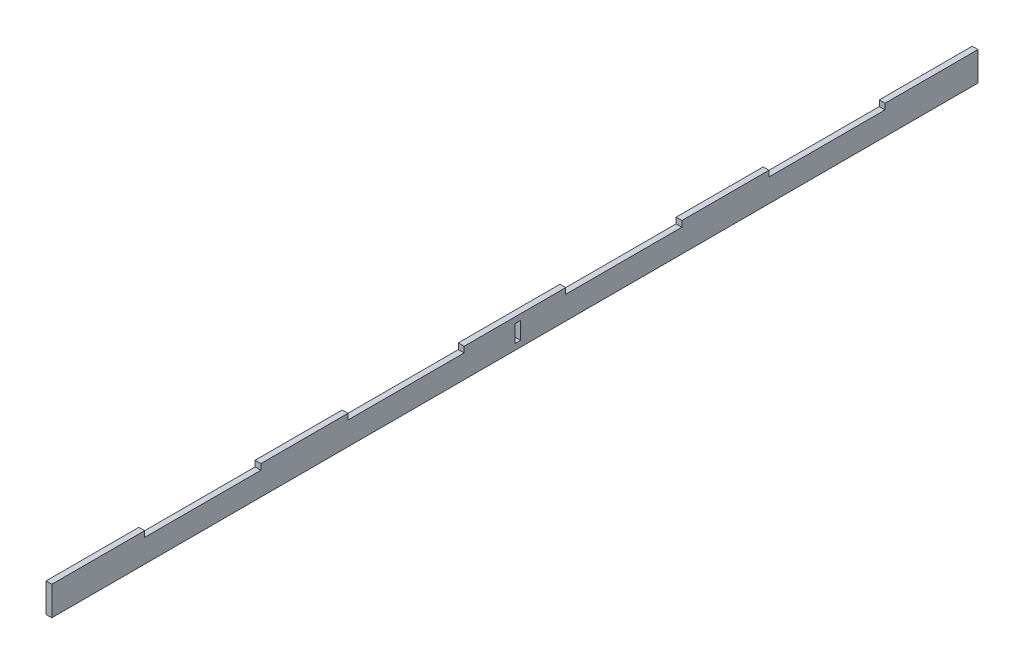
from build123d import *

# Parameters (mm, degrees)
SKETCH1_W               = 319
SKETCH1_H               = 10
BOSS_EXTRUDE1_DEPTH     = 2
CUT_EXTRUDE1_DEPTH      = 160.590883198
CUT_EXTRUDE1_DEPTH_BACK = 160.590883198
SKETCH2_W               = 40
SKETCH2_H               = 2
CUT_EXTRUDE2_DEPTH      = 160.590883198
CUT_EXTRUDE2_DEPTH_BACK = 160.590883198
SKETCH4_W               = 2
SKETCH4_H               = 6


with BuildPart() as part:
    # Sketch1 → Boss-Extrude1 (new body)
    with BuildSketch(Plane(origin=(0, 0, 0), x_dir=(0, 0, -1), z_dir=(1, 0, 0))):
        Rectangle(SKETCH1_W, SKETCH1_H)
    extrude(amount=BOSS_EXTRUDE1_DEPTH)

    # Sketch2 → Cut-Extrude1 (cut, two sides: drawn at the far end of the back side and taken through both)
    with BuildSketch(Plane(origin=(2, 0, 0), x_dir=(0, 0, -1), z_dir=(1, 0, 0)).offset(-CUT_EXTRUDE1_DEPTH_BACK)):
        with Locations((-107.5, 4)):
            Rectangle(SKETCH2_W, SKETCH2_H)
        with Locations((-37.5, 4)):
            Rectangle(SKETCH2_W, SKETCH2_H)
        with Locations((37.5, 4)):
            Rectangle(SKETCH2_W, SKETCH2_H)
        with Locations((107.5, 4)):
            Rectangle(SKETCH2_W, SKETCH2_H)
    extrude(amount=CUT_EXTRUDE1_DEPTH + CUT_EXTRUDE1_DEPTH_BACK, mode=Mode.SUBTRACT)

    # Sketch4 → Cut-Extrude2 (cut, two sides: drawn at the far end of the back side and taken through both)
    with BuildSketch(Plane(origin=(2, 0, 0), x_dir=(0, 0, -1), z_dir=(1, 0, 0)).offset(-CUT_EXTRUDE2_DEPTH_BACK)):
        with Locations((1, 0)):
            Rectangle(SKETCH4_W, SKETCH4_H)
    extrude(amount=CUT_EXTRUDE2_DEPTH + CUT_EXTRUDE2_DEPTH_BACK, mode=Mode.SUBTRACT)


solid = part.part
